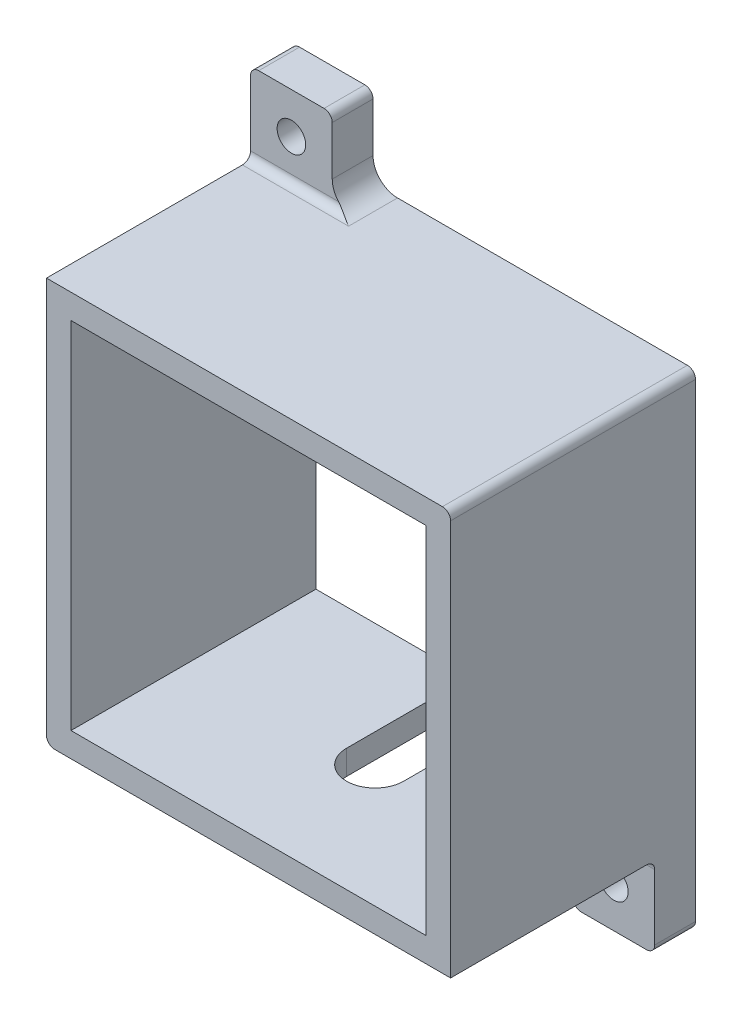
from build123d import *

# Parameters (mm, degrees)
ESQUISSE1_W             = 49.5
ESQUISSE1_H             = 49.5
ESQUISSE1_W_2           = 43.5
ESQUISSE1_H_2           = 43.5
BOSS_EXTRU_1_DEPTH      = 30
ESQUISSE2_W             = 10
ESQUISSE2_H             = 10
ESQUISSE2_R             = 1.75
BOSS_EXTRU_2_DEPTH      = 5
CONG_1_R                = 1
CONG_2_R                = 3
CONG_3_R                = 1
CUT_EXTRUDE1_DEPTH      = 24
CUT_EXTRUDE1_DEPTH_BACK = 21.171554026
SKETCH1_W               = 3.5
SKETCH1_H               = 15


with BuildPart() as part:
    # Esquisse1 → Boss.-Extru.1 (new body)
    with BuildSketch(Plane.XY):
        with Locations((24.75, 24.75)):
            Rectangle(ESQUISSE1_W, ESQUISSE1_H)
        with Locations((24.75, 24.75)):
            Rectangle(ESQUISSE1_W_2, ESQUISSE1_H_2, mode=Mode.SUBTRACT)
    extrude(amount=BOSS_EXTRU_1_DEPTH)

    # Esquisse2 → Boss.-Extru.2 (add)
    # profile 1 of 2: a face of its own
    with BuildSketch(Plane(origin=(0, 0, 0), x_dir=(-1, 0, 0), z_dir=(0, 0, -1))):
        with Locations((-5, 54.5)):
            Rectangle(ESQUISSE2_W, ESQUISSE2_H)
        with Locations((-5, 54.5)):
            Circle(ESQUISSE2_R, mode=Mode.SUBTRACT)
    # profile 2 of 2: a face of its own
    with BuildSketch(Plane(origin=(0, 0, 0), x_dir=(-1, 0, 0), z_dir=(0, 0, -1))):
        with Locations((-44.5, -5)):
            Rectangle(ESQUISSE2_W, ESQUISSE2_H)
        with Locations((-44.5, -5)):
            Circle(ESQUISSE2_R, mode=Mode.SUBTRACT)
    extrude(amount=-BOSS_EXTRU_2_DEPTH)

    # Congé1
    cong_1_edges = [part.edges().sort_by_distance(p)[0] for p in [
        (0, 59.5, 2.5),
        (10, 59.5, 2.5),
        (49.5, -10, 2.5),
        (39.5, -10, 2.5),
        (49.5, 49.5, 15),
        (0, 0, 15),
    ]]
    fillet(cong_1_edges, radius=CONG_1_R)

    # Congé2
    cong_2_edges = [part.edges().sort_by_distance(p)[0] for p in [
        (10, 49.5, 2.5),
        (39.5, 0, 2.5),
    ]]
    fillet(cong_2_edges, radius=CONG_2_R)

    # Congé3
    cong_3_edges = [part.edges().sort_by_distance(p)[0] for p in [
        (6.5, 49.5, 5),
        (43, 0, 5),
    ]]
    fillet(cong_3_edges, radius=CONG_3_R)

    # Sketch1 → Cut-Extrude1 (cut, two sides: drawn at the far end of the back side and taken through both)
    with BuildSketch(Plane.XZ.offset(-CUT_EXTRUDE1_DEPTH_BACK)):
        with BuildLine():
            ThreePointArc((28.75, 15), (25.25, 18.5), (21.75, 15))
            Line((21.75, 15), (25.25, 15))
            Line((25.25, 15), (28.75, 15))
        make_face()
        with Locations((27, 7.5)):
            Rectangle(SKETCH1_W, SKETCH1_H)
        with Locations((23.5, 7.5)):
            Rectangle(SKETCH1_W, SKETCH1_H)
    extrude(amount=CUT_EXTRUDE1_DEPTH + CUT_EXTRUDE1_DEPTH_BACK, mode=Mode.SUBTRACT)


solid = part.part
